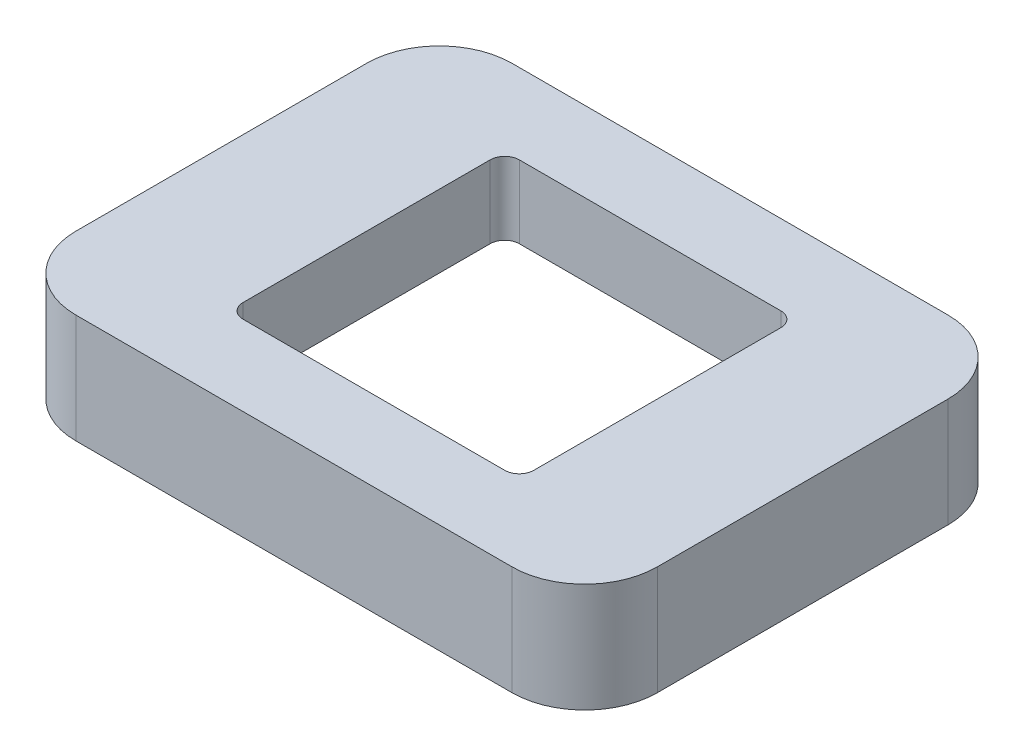
from build123d import *

# Parameters (mm, degrees)
BOSS_EXTRU_1_DEPTH      = 15
ENL_V_MAT_EXTRU_1_DEPTH = 5
ESQUISSE3_R             = 2.8
ENL_V_MAT_EXTRU_2_DEPTH = 8.1


with BuildPart() as part:
    # Esquisse1 → Boss.-Extru.1 (new body)
    with BuildSketch(Plane(origin=(0, 0, 0), x_dir=(1, 0, 0), z_dir=(0, 1, 0))):
        with BuildLine():
            Line((10, 0), (70, 0))
            ThreePointArc((70, 0), (77.071067812, -2.928932188), (80, -10))
            Line((80, -10), (80, -50))
            ThreePointArc((80, -50), (77.071067812, -57.071067812), (70, -60))
            Line((70, -60), (10, -60))
            ThreePointArc((10, -60), (2.928932188, -57.071067812), (0, -50))
            Line((0, -50), (0, -10))
            ThreePointArc((0, -10), (2.928932188, -2.928932188), (10, 0))
        make_face()
        with BuildLine():
            Line((58, -49), (22, -49))
            ThreePointArc((22, -49), (20.585786438, -48.414213562), (20, -47))
            Line((20, -47), (20, -13))
            ThreePointArc((20, -13), (20.585786438, -11.585786438), (22, -11))
            Line((22, -11), (58, -11))
            ThreePointArc((58, -11), (59.414213562, -11.585786438), (60, -13))
            Line((60, -13), (60, -47))
            ThreePointArc((60, -47), (59.414213562, -48.414213562), (58, -49))
        make_face(mode=Mode.SUBTRACT)
    extrude(amount=BOSS_EXTRU_1_DEPTH)

    # Esquisse2 → Enlèv. mat.-Extru.1 (cut)
    with BuildSketch(Plane.XZ):
        with BuildLine():
            Line((8, 57), (72, 57))
            ThreePointArc((72, 57), (75.535533906, 55.535533906), (77, 52))
            Line((77, 52), (77, 8))
            ThreePointArc((77, 8), (75.535533906, 4.464466094), (72, 3))
            Line((72, 3), (8, 3))
            ThreePointArc((8, 3), (4.464466094, 4.464466094), (3, 8))
            Line((3, 8), (3, 52))
            ThreePointArc((3, 52), (4.464466094, 55.535533906), (8, 57))
        make_face()
    extrude(amount=-ENL_V_MAT_EXTRU_1_DEPTH, mode=Mode.SUBTRACT)

    # Esquisse3 → Enlèv. mat.-Extru.2 (cut)
    with BuildSketch(Plane.XZ.offset(-5)):
        with Locations(Location((65, 13.5, 0), (0, 0, 270))):
            Circle(ESQUISSE3_R)
        with Locations(Location((65, 46.5, 0), (0, 0, 270))):
            Circle(ESQUISSE3_R)
        with Locations(Location((15, 13.5, 0), (0, 0, 270))):
            Circle(ESQUISSE3_R)
        with Locations(Location((15, 46.5, 0), (0, 0, 270))):
            Circle(ESQUISSE3_R)
    extrude(amount=-ENL_V_MAT_EXTRU_2_DEPTH, mode=Mode.SUBTRACT)


solid = part.part
